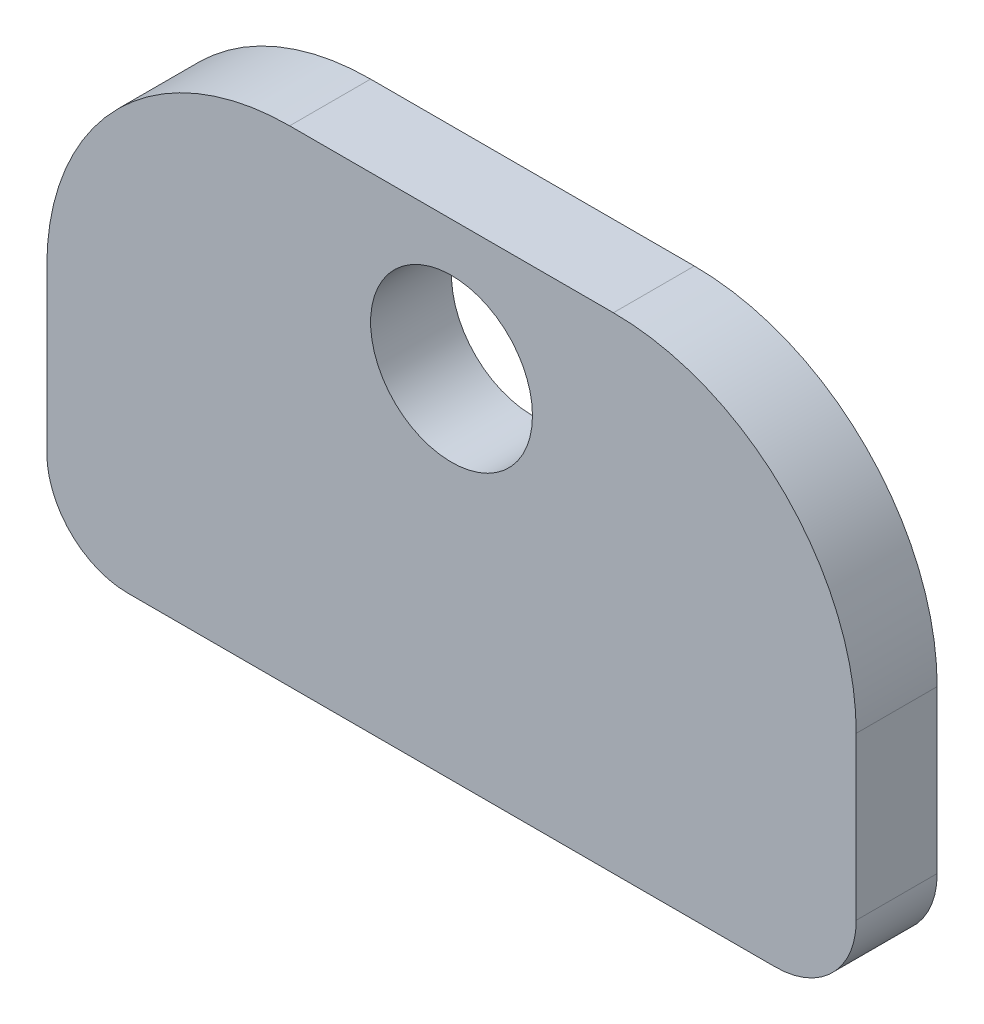
from build123d import *

# Parameters (mm, degrees)
SZKIC1_R                    = 5
DODANIE_WYCI_GNI_CIE1_DEPTH = 5


with BuildPart() as part:
    # Szkic1 → Dodanie-wyciągnięcie1 (new body)
    with BuildSketch(Plane.XY):
        with BuildLine():
            Line((-20, -15), (20, -15))
            ThreePointArc((20, -15), (23.535533906, -13.535533906), (25, -10))
            Line((25, -10), (25, 0))
            ThreePointArc((25, 0), (20.606601718, 10.606601718), (10, 15))
            Line((10, 15), (-10, 15))
            ThreePointArc((-10, 15), (-20.606601718, 10.606601718), (-25, 0))
            Line((-25, 0), (-25, -10))
            ThreePointArc((-25, -10), (-23.535533906, -13.535533906), (-20, -15))
        make_face()
        with Locations((0, 7)):
            Circle(SZKIC1_R, mode=Mode.SUBTRACT)
    extrude(amount=DODANIE_WYCI_GNI_CIE1_DEPTH)


solid = part.part
